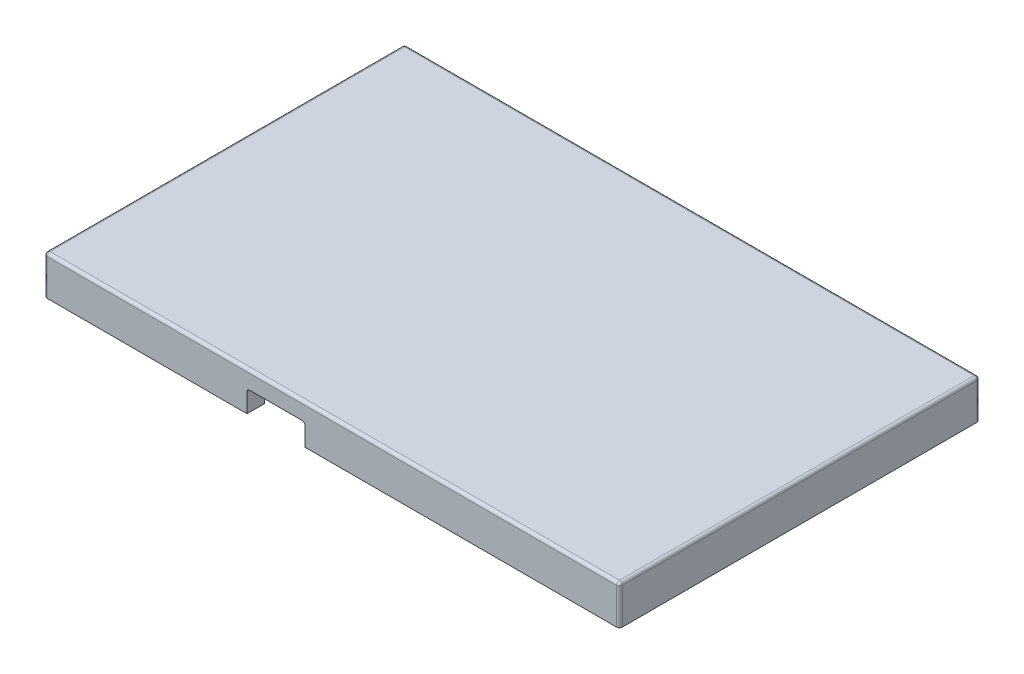
from build123d import *

# Parameters (mm, degrees)
SKETCH1_R           = 1.5
SKETCH1_W           = 14
SKETCH1_H           = 15.525
SKETCH1_W_2         = 46.75
SKETCH1_H_2         = 20.3
BOSS_EXTRUDE1_DEPTH = 3.75
CUT_EXTRUDE1_DEPTH  = 118.232216135
SKETCH3_W           = 99.3
SKETCH3_H           = 62.2
BOSS_EXTRUDE2_DEPTH = 3
SKETCH4_R           = 1.5
CUT_EXTRUDE2_DEPTH  = 4.75
FILLET1_R           = 0.5


with BuildPart() as part:
    # Sketch1 → Boss-Extrude1 (new body)
    with BuildSketch(Plane(origin=(0, 0, 0), x_dir=(1, 0, 0), z_dir=(0, 1, 0))):
        Polygon((0, 62.2), (0, 0), (35, 0), (35, 3), (4.525, 3), (4.525, 18.525), (75.675, 18.525), (75.675, 3), (45, 3), (45, 0), (99.3, 0), (99.3, 62.2), align=None)
        with Locations(Location((10, 25, 0), (0, 0, 270))):
            Circle(SKETCH1_R, mode=Mode.SUBTRACT)
        with Locations(Location((89.25, 10, 0), (0, 0, 270))):
            Circle(SKETCH1_R, mode=Mode.SUBTRACT)
        with Locations((87.725, 29.8125)):
            Rectangle(SKETCH1_W, SKETCH1_H, mode=Mode.SUBTRACT)
        with Locations(Location((25, 47.15, 0), (0, 0, 270))):
            Circle(SKETCH1_R, mode=Mode.SUBTRACT)
        with Locations(Location((74.25, 37.15, 0), (0, 0, 270))):
            Circle(SKETCH1_R, mode=Mode.SUBTRACT)
        with Locations((68.675, 50.3)):
            Rectangle(SKETCH1_W_2, SKETCH1_H_2, mode=Mode.SUBTRACT)
    extrude(amount=BOSS_EXTRUDE1_DEPTH)

    # Sketch2 → Cut-Extrude1 (cut, through all)
    with BuildSketch(Plane.XZ):
        Polygon((19, -18.525), (19, -28), (32, -28), (32, -50), (45.3, -50), (45.3, -40.15), (52, -40.15), (52, -30), (68, -30), (68, -18.525), align=None)
    extrude(amount=-CUT_EXTRUDE1_DEPTH, mode=Mode.SUBTRACT)

    # Sketch3 → Boss-Extrude2 (add)
    with BuildSketch(Plane(origin=(0, 3.75, 0), x_dir=(1, 0, 0), z_dir=(0, 1, 0))):
        with Locations((49.65, 31.1)):
            Rectangle(SKETCH3_W, SKETCH3_H)
    extrude(amount=BOSS_EXTRUDE2_DEPTH)

    # Sketch4 → Cut-Extrude2 (cut)
    with BuildSketch(Plane.XZ):
        with Locations(Location((89.25, -10, 0), (0, 0, 90))):
            Circle(SKETCH4_R)
        with Locations(Location((74.25, -37.15, 0), (0, 0, 90))):
            Circle(SKETCH4_R)
        with Locations(Location((25, -47.15, 0), (0, 0, 90))):
            Circle(SKETCH4_R)
        with Locations(Location((10, -25, 0), (0, 0, 90))):
            Circle(SKETCH4_R)
    extrude(amount=-CUT_EXTRUDE2_DEPTH, mode=Mode.SUBTRACT)

    # Fillet1
    fillet1_edges = [part.edges().sort_by_distance(p)[0] for p in [
        (0, 6.75, -31.1),
        (49.65, 6.75, 0),
        (99.3, 6.75, -31.1),
        (49.65, 6.75, -62.2),
        (0, 3.375, 0),
        (0, 3.375, -62.2),
        (99.3, 3.375, -62.2),
        (99.3, 3.375, 0),
        (35, 3.75, -1.5),
        (45, 3.75, -1.5),
    ]]
    fillet(fillet1_edges, radius=FILLET1_R)


solid = part.part
